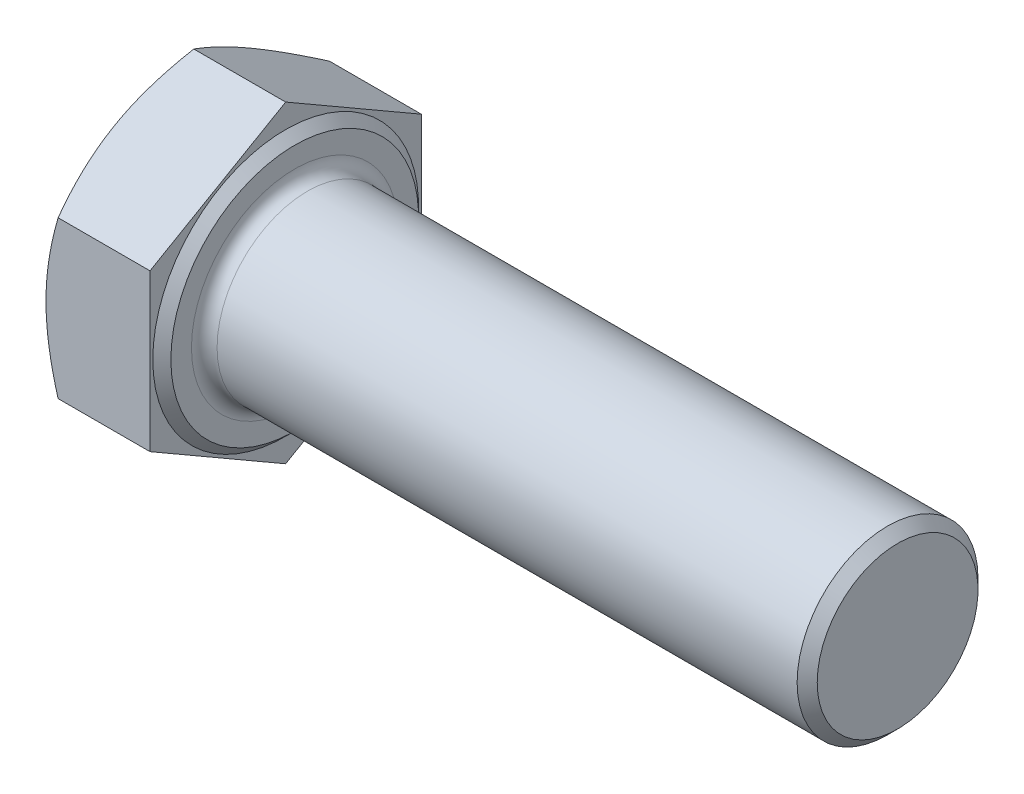
from build123d import *

# Parameters (mm, degrees)
EXTRUDE_1_DEPTH     = 7.5
SKETCH_4_R          = 20.03
SKETCH_4_R_2        = 9
CUT_EXTRUDE_1_DEPTH = 0.9375
CUT_EXTRUDE_1_DRAFT = -60
CHAMFER_2_SIZE      = 0.666666667


with BuildPart() as part:
    # 草图3 → 凸台-拉伸1 (new body)
    with BuildSketch(Plane(origin=(0, 0, 0), x_dir=(0, 0, -1), z_dir=(1, 0, 0))):
        Polygon((9, 5.196152423), (0, 10.392304845), (-9, 5.196152423), (-9, -5.196152423), (0, -10.392304845), (9, -5.196152423), align=None)
    extrude(amount=EXTRUDE_1_DEPTH)


with BuildPart() as cut_extrude_1_tool:
    # 草图4 → 切除-拉伸1 (with draft: the straight prism first)
    with BuildSketch(Plane.ZY):
        Circle(SKETCH_4_R)
        Circle(SKETCH_4_R_2, mode=Mode.SUBTRACT)
    extrude(amount=-CUT_EXTRUDE_1_DEPTH)
    # 切除-拉伸1: the draft: its side faces are tilted about the plane it starts from
    cut_extrude_1_sides = [cut_extrude_1_tool.faces().sort_by_distance(p)[0] for p in [
        (0.46875, 0, -20.03),
        (0.46875, 0, -9),
    ]]
    draft(cut_extrude_1_sides, Plane.ZY, CUT_EXTRUDE_1_DRAFT)


with BuildPart() as part_1:
    add(part.part)

    # 切除-拉伸1: cut by cut_extrude_1_tool
    add(cut_extrude_1_tool.part, mode=Mode.SUBTRACT)

    # 草图5 → 旋转1 (revolve)
    with BuildSketch(Plane.XY, mode=Mode.PRIVATE) as revolve_1_sk:
        with BuildLine():
            Line((8.35, 6), (47.5, 6))
            Line((47.5, 6), (47.5, 0))
            Line((47.5, 0), (7.5, 0))
            Line((7.5, 0), (7.5, 6.85))
            ThreePointArc((7.5, 6.85), (7.748959236, 6.248959236), (8.35, 6))
        make_face()
    revolve(revolve_1_sk.sketch.rotate(Axis((7.5, 0, 0), (1, 0, 0)), 90), axis=Axis((7.5, 0, 0), (1, 0, 0)))

    # 倒角2
    chamfer_2_edges = [part_1.edges().sort_by_distance(p)[0] for p in [
        (47.5, 0, -6),
    ]]
    chamfer(chamfer_2_edges, length=CHAMFER_2_SIZE)

    # 草图7 → 切除-旋转1 (revolve, cut)
    with BuildSketch(Plane.XY, mode=Mode.PRIVATE) as cut_revolve_1_sk:
        Polygon((7.5, 8.215), (6.9, 8.815), (6.9, 20.03), (7.5, 20.03), align=None)
    revolve(cut_revolve_1_sk.sketch.rotate(Axis((0, 0, 0), (1, 0, 0)), 90), axis=Axis((0, 0, 0), (1, 0, 0)), mode=Mode.SUBTRACT)


solid = part_1.part
